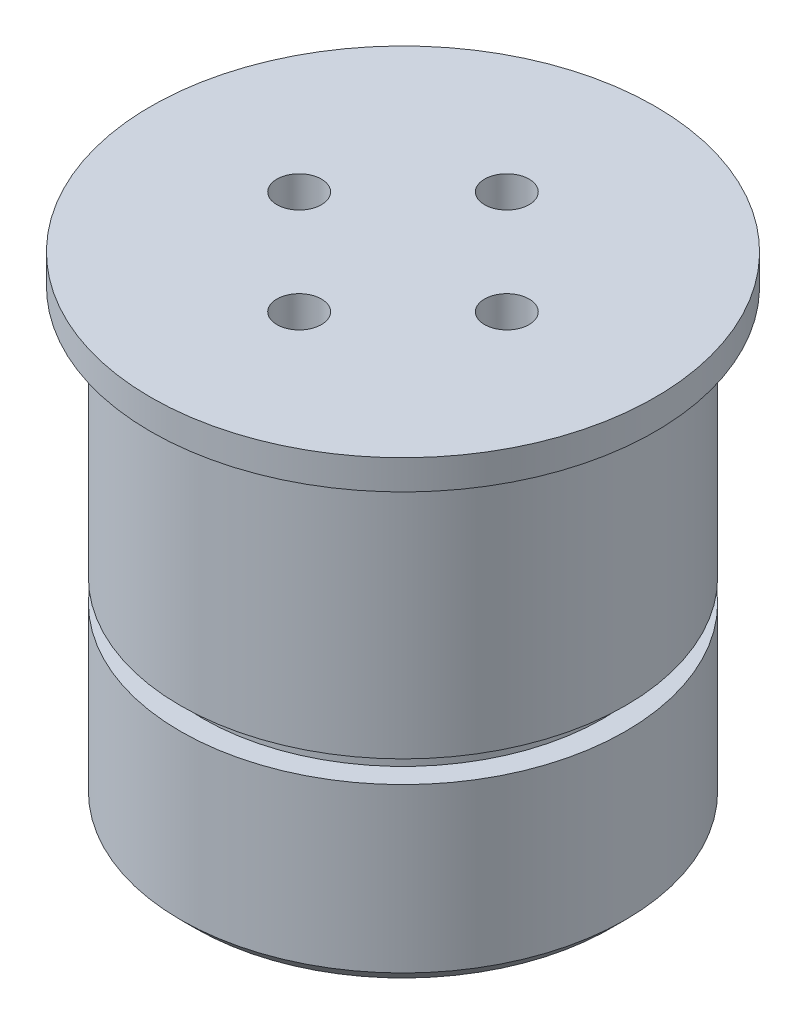
from build123d import *

# Parameters (mm, degrees)
CHAMFER_1_SIZE           = 1
SKETCH_8_R               = 1.5
CUT_EXTRUDE_1_DEPTH      = 30
PATTERN_CIRCULAR_1_COUNT = 4


with BuildPart() as part:
    # Эскиз7 → Повернуть1 (revolve)
    with BuildSketch(Plane(origin=(0, 0, 0), x_dir=(0, 0, -1), z_dir=(1, 0, 0)), mode=Mode.PRIVATE) as revolve_1_sk:
        Polygon((10, 0), (15, 0), (15, 12), (13.5, 12), (13.5, 13.5), (15, 13.5), (15, 30.5), (17, 30.5), (17, 32.5), (0, 32.5), (0, 2.5), (10, 2.5), align=None)
    revolve(revolve_1_sk.sketch.rotate(Axis((0, 32.703148984, 0), (0, -1, 0)), 180), axis=Axis((0, 32.703148984, 0), (0, -1, 0)))

    # Фаска1
    chamfer_1_edges = [part.edges().sort_by_distance(p)[0] for p in [
        (0, 0, -15),
    ]]
    chamfer(chamfer_1_edges, length=CHAMFER_1_SIZE)

    # Эскиз8 → Вырез-Вытянуть1 (cut)
    with BuildSketch(Plane.XZ.offset(-2.5)):
        with Locations(Location((7, 0, 0), (0, 0, 270))):
            Circle(SKETCH_8_R)
    cut_extrude_1 = extrude(amount=-CUT_EXTRUDE_1_DEPTH, mode=Mode.SUBTRACT)

    # Круговой массив1: Вырез-Вытянуть1 ×4 about axis
    pattern_circular_1_axis = Axis((0, 0, 0), (0, 1, 0))
    for i in range(1, PATTERN_CIRCULAR_1_COUNT):
        add(cut_extrude_1.rotate(pattern_circular_1_axis, i * 360 / PATTERN_CIRCULAR_1_COUNT), mode=Mode.SUBTRACT)


solid = part.part
